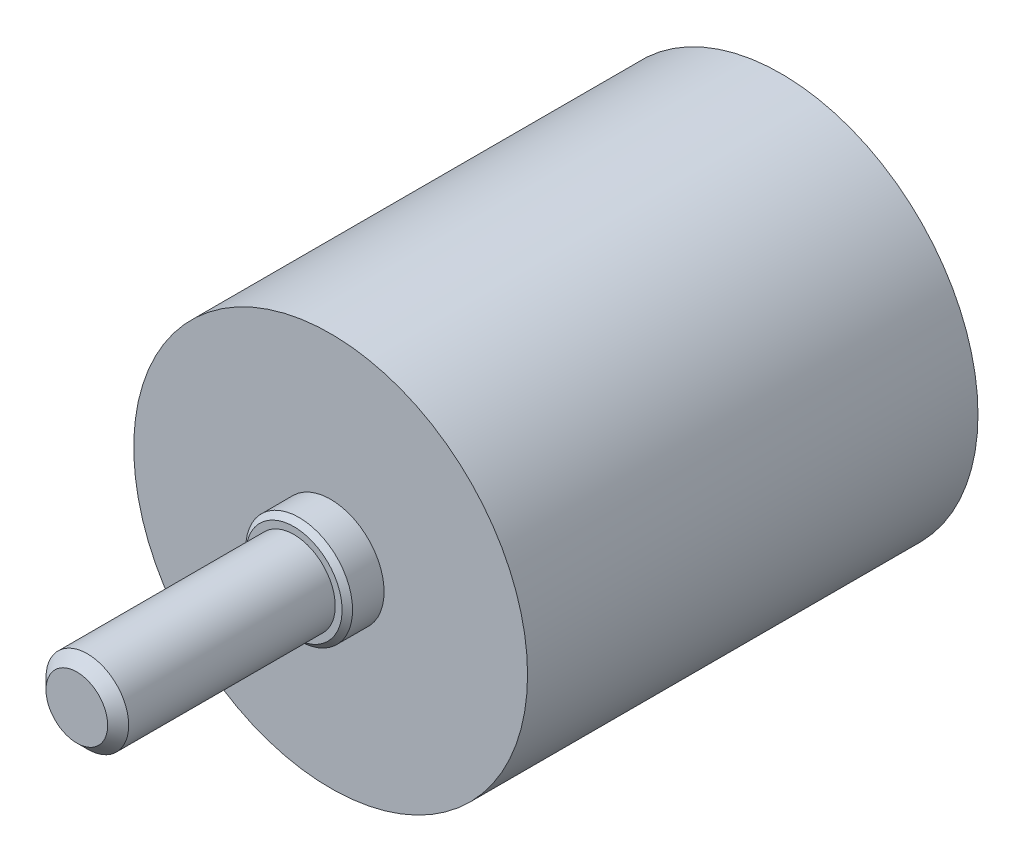
from build123d import *

# Parameters (mm, degrees)
CHAMFER1_SIZE = 1.016
CHAMFER2_SIZE = 0.508


with BuildPart() as part:
    # Sketch1 → Revolve1 (revolve)
    with BuildSketch(Plane(origin=(0, 0, 0), x_dir=(0, 0, -1), z_dir=(1, 0, 0)), mode=Mode.PRIVATE) as revolve1_sk:
        Polygon((0, 0), (0, 4), (21, 4), (21, 5.1689), (24.556, 5.1689), (24.556, 19.05), (68.134749365, 19.05), (68.134749365, 5.1689), (72.7964, 5.1689), (72.7964, 0), align=None)
    revolve(revolve1_sk.sketch.rotate(Axis((0, 0, 0), (0, 0, -1)), 90), axis=Axis((0, 0, 0), (0, 0, -1)))

    # Chamfer1
    chamfer1_edges = [part.edges().sort_by_distance(p)[0] for p in [
        (-4, 0, 0),
    ]]
    chamfer(chamfer1_edges, length=CHAMFER1_SIZE)

    # Chamfer2
    chamfer2_edges = [part.edges().sort_by_distance(p)[0] for p in [
        (-5.1689, 0, -72.7964),
        (-5.1689, 0, -21),
    ]]
    chamfer(chamfer2_edges, length=CHAMFER2_SIZE)


solid = part.part
